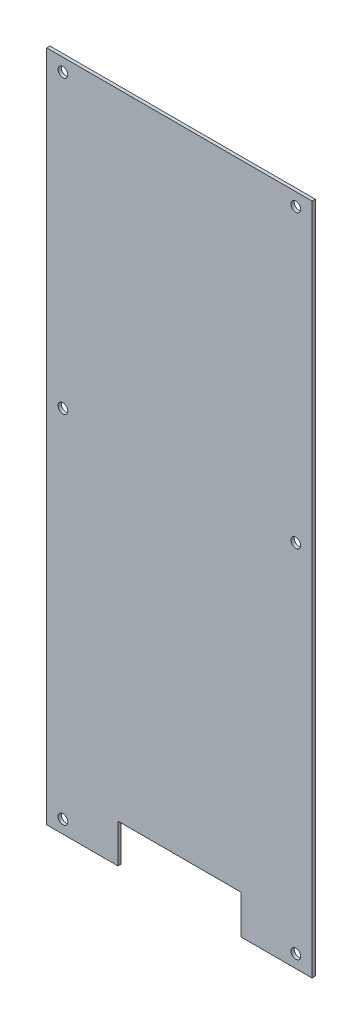
from build123d import *

# Parameters (mm, degrees)
SKETCH1_W                = 82
SKETCH1_H                = 208
BOSS_EXTRUDE1_DEPTH      = 1
F_3_0_3_DIAMETER_HOLE1_D = 3
SKETCH4_W                = 38
SKETCH4_H                = 12
CUT_EXTRUDE1_DEPTH       = 10


with BuildPart() as part:
    # Sketch1 → Boss-Extrude1 (new body)
    with BuildSketch(Plane.XY):
        Rectangle(SKETCH1_W, SKETCH1_H)
    extrude(amount=BOSS_EXTRUDE1_DEPTH)

    # Ø3.0 (3) Diameter Hole1 (through all)
    with Locations(Plane.XY.offset(1)):
        with Locations((-36, 10), (36, 10), (36, -100), (-36, -100), (-36, 100), (36, 100)):
            Hole(F_3_0_3_DIAMETER_HOLE1_D / 2)

    # Sketch4 → Cut-Extrude1 (cut)
    with BuildSketch(Plane.XY.offset(1)):
        with Locations((0, -98)):
            Rectangle(SKETCH4_W, SKETCH4_H)
    extrude(amount=-CUT_EXTRUDE1_DEPTH, mode=Mode.SUBTRACT)


solid = part.part
